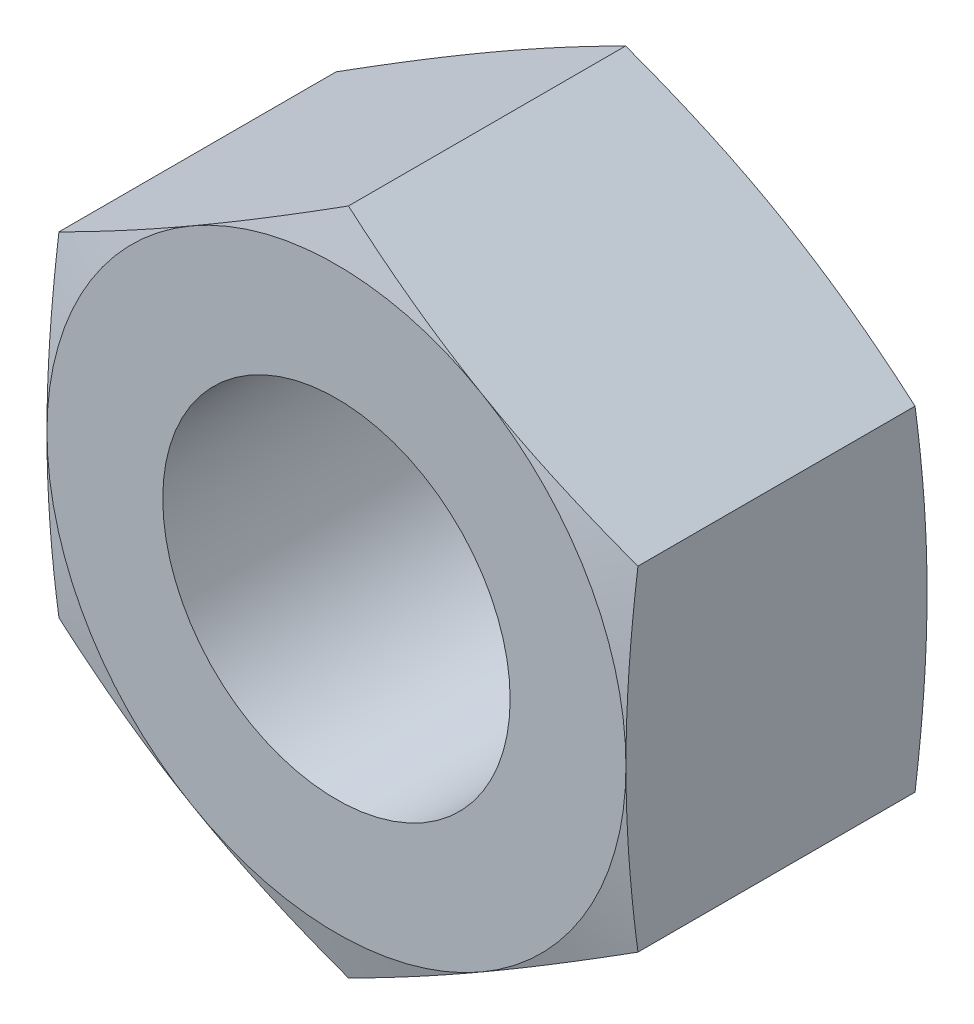
from build123d import *

# Parameters (mm, degrees)
SKETCH1_R           = 3
BOSS_EXTRUDE1_DEPTH = 5.2


with BuildPart() as part:
    # Sketch1 → Boss-Extrude1 (new body)
    with BuildSketch(Plane.XY):
        Polygon((0, 5.773502692), (-5, 2.886751346), (-5, -2.886751346), (0, -5.773502692), (5, -2.886751346), (5, 2.886751346), align=None)
        Circle(SKETCH1_R, mode=Mode.SUBTRACT)
    extrude(amount=BOSS_EXTRUDE1_DEPTH)

    # Sketch2 → Cut-Revolve2 (revolve, cut)
    with BuildSketch(Plane(origin=(0, 0, 0), x_dir=(0, 0, -1), z_dir=(0, 1, 0))):
        Polygon((-4.396152423, -8), (-6.405771366, -0.5), (-6.405771366, -8), align=None)
    cut_revolve2 = revolve(axis=Axis((0, 0, -2.80878951), (0, 0, 1)), mode=Mode.SUBTRACT)

    # Mirror1: Cut-Revolve2 across plane
    add(cut_revolve2.mirror(Plane.XY.offset(2.6)), mode=Mode.SUBTRACT)


solid = part.part
